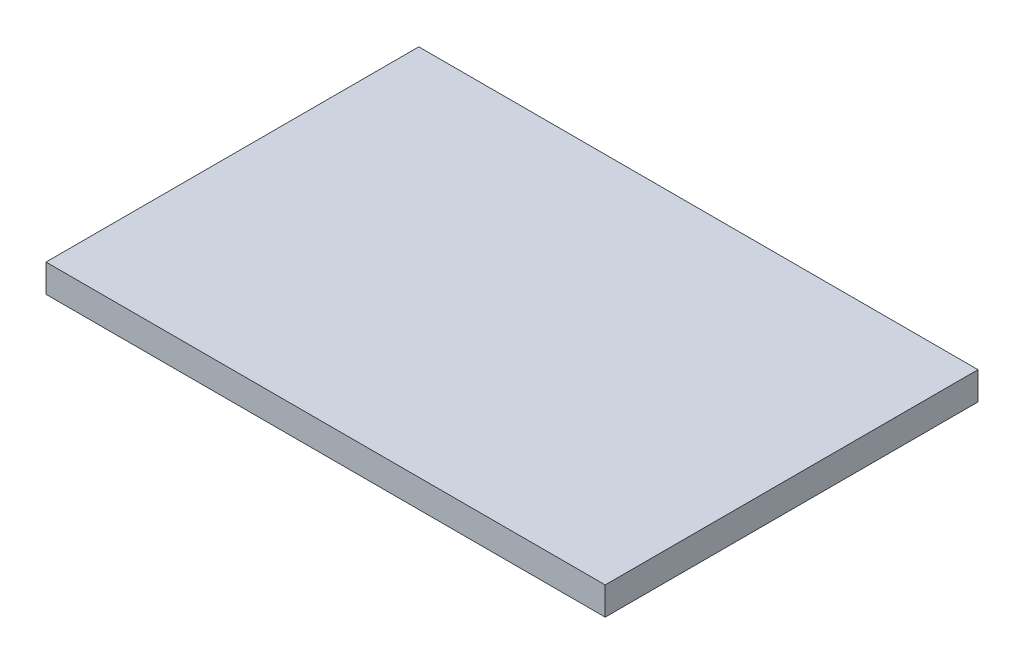
from build123d import *

# Parameters (mm, degrees)
SKETCH1_W      = 60
SKETCH1_H      = 40
EXTRUDE1_DEPTH = 3


with BuildPart() as part:
    # Sketch1 → Extrude1 (new body)
    with BuildSketch(Plane(origin=(0, 0, 0), x_dir=(1, 0, 0), z_dir=(0, 1, 0))):
        with Locations((30, 20)):
            Rectangle(SKETCH1_W, SKETCH1_H)
    extrude(amount=EXTRUDE1_DEPTH)


solid = part.part
